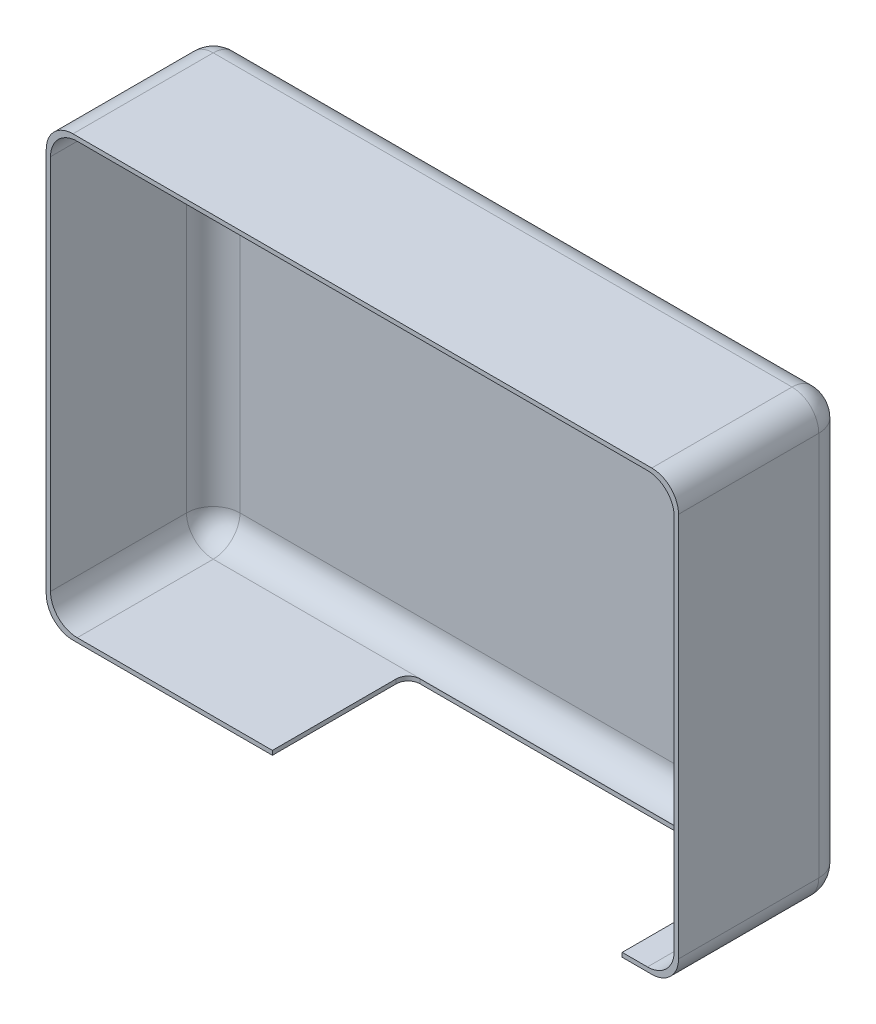
from build123d import *

# Parameters (mm, degrees)
BOSS_EXTRUDE1_DEPTH = 88.9
CUT_EXTRUDE1_DEPTH  = 86.614
FILLET1_R           = 14.224
FILLET2_R           = 14.224
CUT_EXTRUDE2_DEPTH  = 2.286


with BuildPart() as part:
    # Sketch1 → Boss-Extrude1 (new body)
    with BuildSketch(Plane.XY):
        with BuildLine():
            Line((-41.405944168, 22.056216238), (266.696055832, 22.056216238))
            ThreePointArc((266.696055832, 22.056216238), (276.753942688, 17.890103094), (280.920055832, 7.832216238))
            Line((280.920055832, 7.832216238), (280.920055832, -197.145783762))
            ThreePointArc((280.920055832, -197.145783762), (276.753942688, -207.203670617), (266.696055832, -211.369783762))
            Line((266.696055832, -211.369783762), (-41.405944168, -211.369783762))
            ThreePointArc((-41.405944168, -211.369783762), (-51.463831024, -207.203670617), (-55.629944168, -197.145783762))
            Line((-55.629944168, -197.145783762), (-55.629944168, 7.832216238))
            ThreePointArc((-55.629944168, 7.832216238), (-51.463831024, 17.890103094), (-41.405944168, 22.056216238))
        make_face()
    extrude(amount=BOSS_EXTRUDE1_DEPTH)

    # Sketch4 → Cut-Extrude1 (cut)
    with BuildSketch(Plane.XY.offset(88.9)):
        with BuildLine():
            Line((-39.119944168, -209.083783762), (264.410055832, -209.083783762))
            ThreePointArc((264.410055832, -209.083783762), (274.467942688, -204.917670617), (278.634055832, -194.859783762))
            Line((278.634055832, -194.859783762), (278.634055832, 5.546216238))
            ThreePointArc((278.634055832, 5.546216238), (274.467942688, 15.604103094), (264.410055832, 19.770216238))
            Line((264.410055832, 19.770216238), (-39.119944168, 19.770216238))
            ThreePointArc((-39.119944168, 19.770216238), (-49.177831024, 15.604103094), (-53.343944168, 5.546216238))
            Line((-53.343944168, 5.546216238), (-53.343944168, -194.859783762))
            ThreePointArc((-53.343944168, -194.859783762), (-49.177831024, -204.917670617), (-39.119944168, -209.083783762))
        make_face()
    extrude(amount=-CUT_EXTRUDE1_DEPTH, mode=Mode.SUBTRACT)

    # Fillet1
    fillet1_edges = [part.edges().sort_by_distance(p)[0] for p in [
        (-49.177831024, -204.917670617, 2.286),
        (-53.343944168, -94.656783762, 2.286),
        (-49.177831024, 15.604103094, 2.286),
        (112.645055832, 19.770216238, 2.286),
        (274.467942688, 15.604103094, 2.286),
        (278.634055832, -94.656783762, 2.286),
        (274.467942688, -204.917670617, 2.286),
        (112.645055832, -209.083783762, 2.286),
    ]]
    fillet(fillet1_edges, radius=FILLET1_R)

    # Fillet2
    fillet2_edges = [part.edges().sort_by_distance(p)[0] for p in [
        (-55.629944168, -94.656783762, 0),
        (-51.463831024, 17.890103094, 0),
        (112.645055832, 22.056216238, 0),
        (276.753942688, 17.890103094, 0),
        (280.920055832, -94.656783762, 0),
        (276.753942688, -207.203670617, 0),
        (112.645055832, -211.369783762, 0),
        (-51.463831024, -207.203670617, 0),
    ]]
    fillet(fillet2_edges, radius=FILLET2_R)

    # Sketch5 → Cut-Extrude2 (cut)
    with BuildSketch(Plane(origin=(0, -211.369783762, 0), x_dir=(-1, 0, 0), z_dir=(0, -1, 0))):
        with BuildLine():
            Line((-64.758151491, -88.9), (-64.758151491, -22.994419779))
            ThreePointArc((-64.758151491, -22.994419779), (-66.61802343, -18.504291719), (-71.108151491, -16.644419779))
            Line((-71.108151491, -16.644419779), (-244.615767903, -16.644419779))
            ThreePointArc((-244.615767903, -16.644419779), (-249.105895963, -18.504291719), (-250.965767903, -22.994419779))
            Line((-250.965767903, -22.994419779), (-250.965767903, -88.9))
            Line((-250.965767903, -88.9), (-64.758151491, -88.9))
        make_face()
    extrude(amount=-CUT_EXTRUDE2_DEPTH, mode=Mode.SUBTRACT)


solid = part.part
